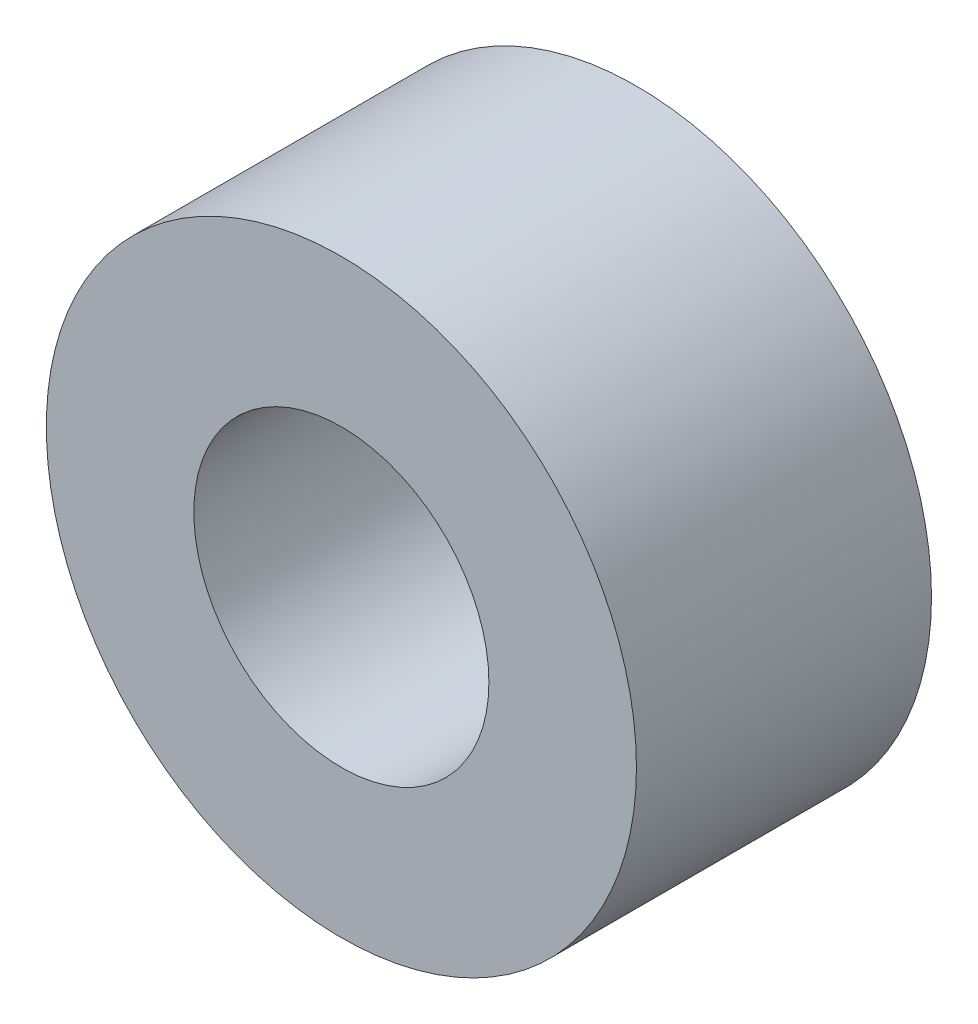
from build123d import *

# Parameters (mm, degrees)
SKETCH1_R           = 12.7
SKETCH1_R_2         = 6.35
BOSS_EXTRUDE1_DEPTH = 6.35


with BuildPart() as part:
    # Sketch1 → Boss-Extrude1 (new, symmetric)
    with BuildSketch(Plane.XY):
        Circle(SKETCH1_R)
        Circle(SKETCH1_R_2, mode=Mode.SUBTRACT)
    extrude(amount=BOSS_EXTRUDE1_DEPTH, both=True)


solid = part.part
